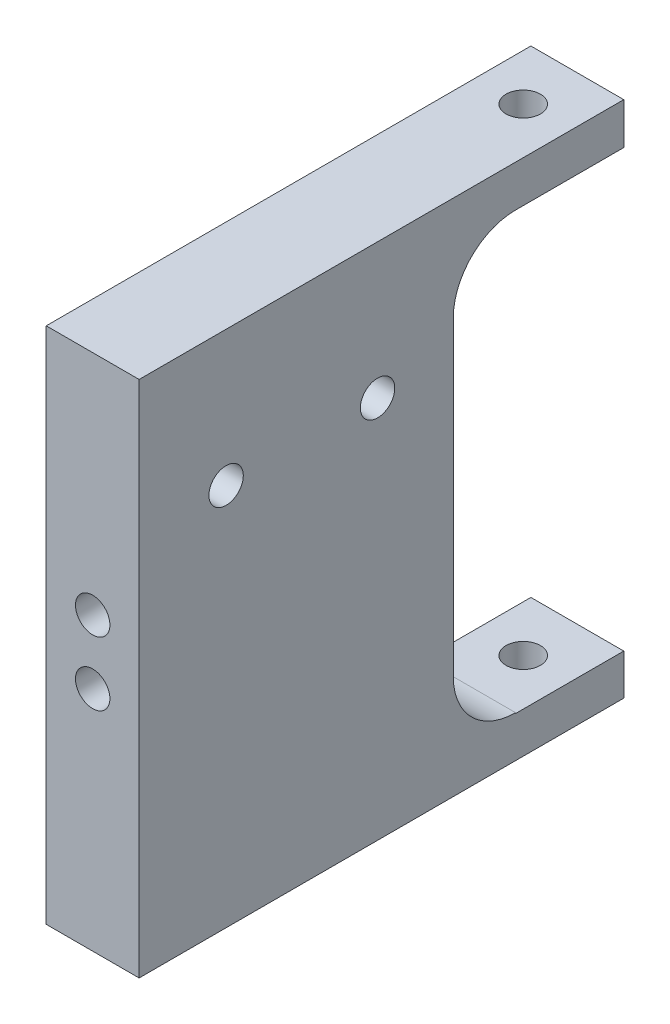
from build123d import *

# Parameters (mm, degrees)
SKETCH1_W           = 41.656
SKETCH1_H           = 60.855895471
BOSS_EXTRUDE1_DEPTH = 10.905899582
CUT_EXTRUDE1_DEPTH  = 59.321153171
SKETCH5_W           = 2.0193
SKETCH5_H           = 60.855895471
SKETCH6_W           = 2.0193
SKETCH6_H           = 12.7
SKETCH7_W           = 2.0193
SKETCH7_H           = 12.7
SKETCH8_W           = 10.905899582
SKETCH8_H           = 60.855895471
SKETCH8_R           = 2.0193
BOSS_EXTRUDE2_DEPTH = 15.24
SKETCH9_R           = 2.0193
CUT_EXTRUDE2_DEPTH  = 68.202629317


with BuildPart() as part:
    # Sketch1 → Boss-Extrude1 (new body)
    with BuildSketch(Plane(origin=(27.95338, 0, 0), x_dir=(0, 0, -1), z_dir=(1, 0, 0))):
        with Locations((-8.128, -19.008560287)):
            Rectangle(SKETCH1_W, SKETCH1_H)
    extrude(amount=-BOSS_EXTRUDE1_DEPTH)

    # Sketch2 → Cut-Extrude1 (cut, through all)
    with BuildSketch(Plane.ZY.offset(-17.047480418)):
        with BuildLine():
            Line((-12.7, 6.54304), (-12.7, -44.64304))
            Line((-12.7, -44.64304), (0, -44.64304))
            Line((0, -44.64304), (0, -44.560160575))
            ThreePointArc((0, -44.560160575), (5.172627526, -42.4175881), (7.3152, -37.244960575))
            Line((7.3152, -37.244960575), (7.3152, -0.77216))
            ThreePointArc((7.3152, -0.77216), (5.172627526, 4.400467526), (0, 6.54304))
            Line((0, 6.54304), (-12.7, 6.54304))
        make_face()
    extrude(amount=-CUT_EXTRUDE1_DEPTH, mode=Mode.SUBTRACT)

    # Sketch5 → Cut-Revolve3 (revolve, cut)
    with BuildSketch(Plane(origin=(0, 0, -6.35), x_dir=(-1, 0, 0), z_dir=(0, 0, -1)), mode=Mode.PRIVATE) as cut_revolve3_sk:
        with Locations((-23.510080209, -19.008560287)):
            Rectangle(SKETCH5_W, SKETCH5_H)
    revolve(cut_revolve3_sk.sketch.rotate(Axis((22.500430209, -49.436508023, -6.35), (0, 1, 0)), 270), axis=Axis((22.500430209, -49.436508023, -6.35), (0, 1, 0)), mode=Mode.SUBTRACT)

    # Sketch6 → Cut-Revolve4 (revolve, cut)
    with BuildSketch(Plane(origin=(0, -22.756653096, 0), x_dir=(1, 0, 0), z_dir=(0, 1, 0))):
        with Locations((23.510080209, -22.606)):
            Rectangle(SKETCH6_W, SKETCH6_H)
    revolve(axis=Axis((22.500430209, -22.756653096, 16.256), (0, 0, 1)), mode=Mode.SUBTRACT)

    # Sketch7 → Cut-Revolve5 (revolve, cut)
    with BuildSketch(Plane(origin=(0, -15.260467479, 0), x_dir=(1, 0, 0), z_dir=(0, 1, 0))):
        with Locations((23.510080209, -22.606)):
            Rectangle(SKETCH7_W, SKETCH7_H)
    revolve(axis=Axis((22.500430209, -15.260467479, 16.256), (0, 0, 1)), mode=Mode.SUBTRACT)

    # Sketch8 → Boss-Extrude2 (add)
    with BuildSketch(Plane.XY.offset(28.956)):
        with Locations((22.500430209, -19.008560287)):
            Rectangle(SKETCH8_W, SKETCH8_H)
        with Locations((22.500430209, -22.756653096)):
            Circle(SKETCH8_R, mode=Mode.SUBTRACT)
        with Locations((22.500430209, -15.260467479)):
            Circle(SKETCH8_R, mode=Mode.SUBTRACT)
    extrude(amount=BOSS_EXTRUDE2_DEPTH)

    # Sketch9 → Cut-Extrude2 (cut, through all)
    with BuildSketch(Plane(origin=(27.95338, 0, 0), x_dir=(0, 0, -1), z_dir=(1, 0, 0))):
        with Locations((-33.9852, -4.465939121)):
            Circle(SKETCH9_R)
        with Locations((-16.2052, -4.465939121)):
            Circle(SKETCH9_R)
    extrude(amount=-CUT_EXTRUDE2_DEPTH, mode=Mode.SUBTRACT)


solid = part.part
